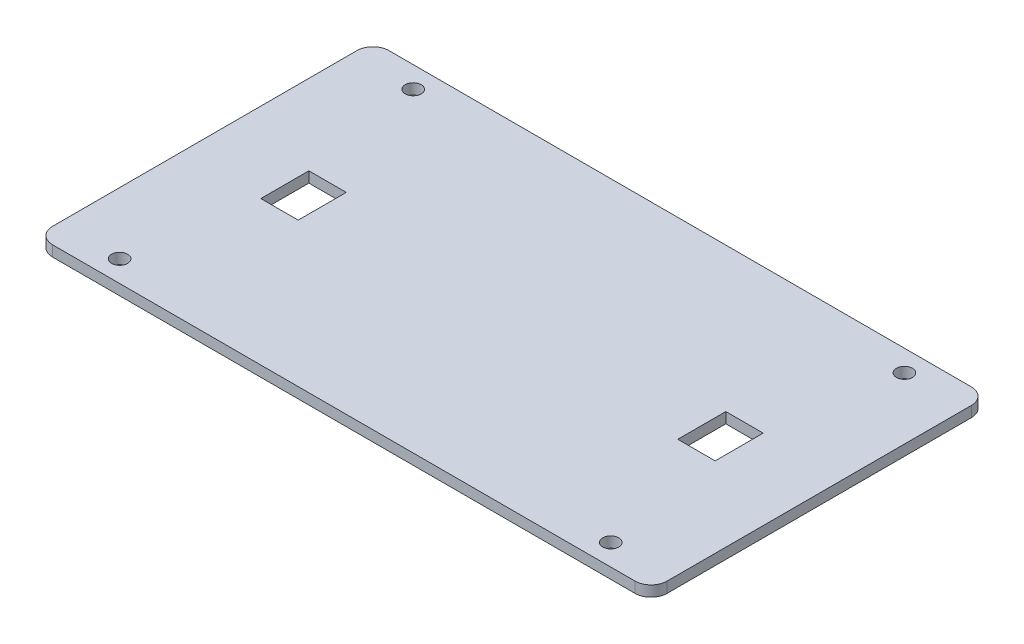
from build123d import *

# Parameters (mm, degrees)
ESBO_O1_W                  = 115.09677689
ESBO_O1_H                  = 63
RESSALTO_EXTRUS_O1_DEPTH   = 2
FILETE1_R                  = 3
CORTE_EXTRUS_O4_DEPTH      = 66.635866816
CORTE_EXTRUS_O4_DEPTH_BACK = 66.635866816
ESBO_O6_W                  = 7
ESBO_O6_H                  = 9
ESBO_O7_R                  = 1.5
CORTE_EXTRUS_O5_DEPTH      = 66.635866816


with BuildPart() as part:
    # Esboço1 → Ressalto-extrusão1 (new body)
    with BuildSketch(Plane(origin=(0, 0, 0), x_dir=(1, 0, 0), z_dir=(0, 1, 0))):
        Rectangle(ESBO_O1_W, ESBO_O1_H)
    extrude(amount=RESSALTO_EXTRUS_O1_DEPTH)

    # Filete1
    filete1_edges = [part.edges().sort_by_distance(p)[0] for p in [
        (-57.548388445, 1, -31.5),
        (57.548388445, 1, -31.5),
        (57.548388445, 1, 31.5),
        (-57.548388445, 1, 31.5),
    ]]
    fillet(filete1_edges, radius=FILETE1_R)

    # Esboço6 → Corte-extrusão4 (cut, two sides: drawn at the far end of the back side and taken through both)
    with BuildSketch(Plane(origin=(0, 2, 0), x_dir=(1, 0, 0), z_dir=(0, 1, 0)).offset(-CORTE_EXTRUS_O4_DEPTH_BACK)):
        with Locations((-39.048388445, 0)):
            Rectangle(ESBO_O6_W, ESBO_O6_H)
        with Locations((39.048388445, 0)):
            Rectangle(ESBO_O6_W, ESBO_O6_H)
    extrude(amount=CORTE_EXTRUS_O4_DEPTH + CORTE_EXTRUS_O4_DEPTH_BACK, mode=Mode.SUBTRACT)

    # Esboço7 → Corte-extrusão5 (cut, through all)
    with BuildSketch(Plane(origin=(0, 2, 0), x_dir=(1, 0, 0), z_dir=(0, 1, 0))):
        with Locations(Location((-45.998388445, 27.5, 0), (0, 0, 270))):
            Circle(ESBO_O7_R)
        with Locations(Location((45.998388445, 27.5, 0), (0, 0, 90))):
            Circle(ESBO_O7_R)
        with Locations(Location((45.998388445, -27.5, 0), (0, 0, 270))):
            Circle(ESBO_O7_R)
        with Locations(Location((-45.998388445, -27.5, 0), (0, 0, 90))):
            Circle(ESBO_O7_R)
    extrude(amount=-CORTE_EXTRUS_O5_DEPTH, mode=Mode.SUBTRACT)


solid = part.part
